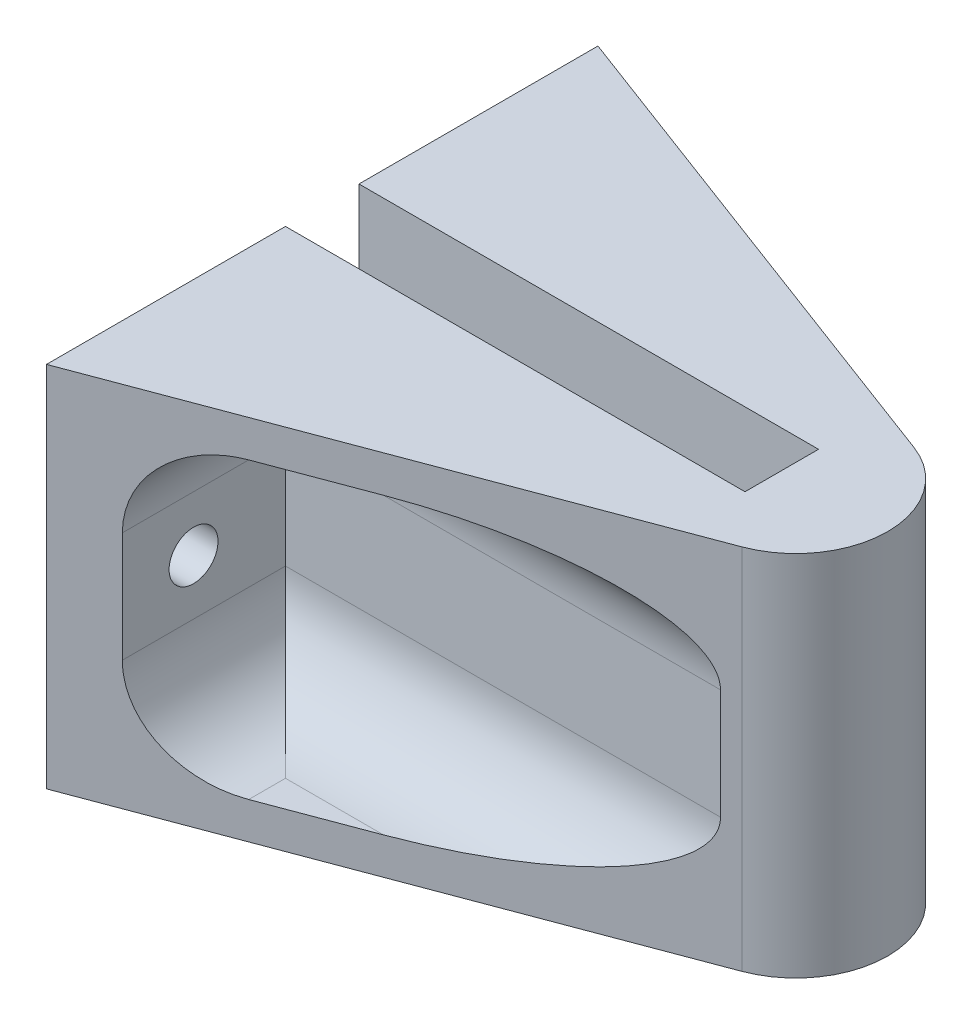
from build123d import *

# Parameters (mm, degrees)
EXTRUDE_1_DEPTH     = 20
SKETCH_2_W          = 25
SKETCH_2_H          = 4
CUT_EXTRUDE_1_DEPTH = 20
CUT_EXTRUDE_START   = -3
SKETCH_3_W          = 10
SKETCH_3_H          = 16
CUT_EXTRUDE_2_DEPTH = 30
SKETCH_4_R          = 1.330699037
CUT_EXTRUDE_3_DEPTH = 3
FILLET_2_R          = 5
FILLET_3_R          = 5


with BuildPart() as part:
    # Эскиз1 → Бобышка-Вытянуть1 (new body)
    with BuildSketch(Plane(origin=(0, 0, 0), x_dir=(1, 0, 0), z_dir=(0, 1, 0))):
        Polygon((0, 0), (0, 30), (40, 15), align=None)
    extrude(amount=EXTRUDE_1_DEPTH)

    # Эскиз2 → Вырез-Вытянуть1 (cut)
    with BuildSketch(Plane(origin=(0, 20, 0), x_dir=(1, 0, 0), z_dir=(0, 1, 0))):
        with Locations((12.5, 15)):
            Rectangle(SKETCH_2_W, SKETCH_2_H)
    extrude(amount=-CUT_EXTRUDE_1_DEPTH, mode=Mode.SUBTRACT)

    # Эскиз3 → Вырез-Вытянуть2 (cut)
    with BuildSketch(Plane.ZY.offset(CUT_EXTRUDE_START)):
        with Locations((-25, 10)):
            Rectangle(SKETCH_3_W, SKETCH_3_H)
        with Locations((-5, 10)):
            Rectangle(SKETCH_3_W, SKETCH_3_H)
    extrude(amount=-CUT_EXTRUDE_2_DEPTH, mode=Mode.SUBTRACT)

    # Эскиз4 → Вырез-Вытянуть3 (cut)
    with BuildSketch(Plane.ZY):
        with Locations((-25, 10)):
            Circle(SKETCH_4_R)
        with Locations((-5, 10)):
            Circle(SKETCH_4_R)
    extrude(amount=-CUT_EXTRUDE_3_DEPTH, mode=Mode.SUBTRACT)

    # Скругление2
    fillet_2_edges = [part.edges().sort_by_distance(p)[0] for p in [
        (40, 10, -15),
    ]]
    fillet(fillet_2_edges, radius=FILLET_2_R)

    # Скругление3
    fillet_3_edges = [part.edges().sort_by_distance(p)[0] for p in [
        (14.833333333, 18, -20),
        (14.833333333, 2, -20),
        (3, 2, -24.4375),
        (3, 18, -24.4375),
        (14.833333333, 2, -10),
        (14.833333333, 18, -10),
        (3, 18, -5.5625),
        (3, 2, -5.5625),
    ]]
    fillet(fillet_3_edges, radius=FILLET_3_R)


solid = part.part
